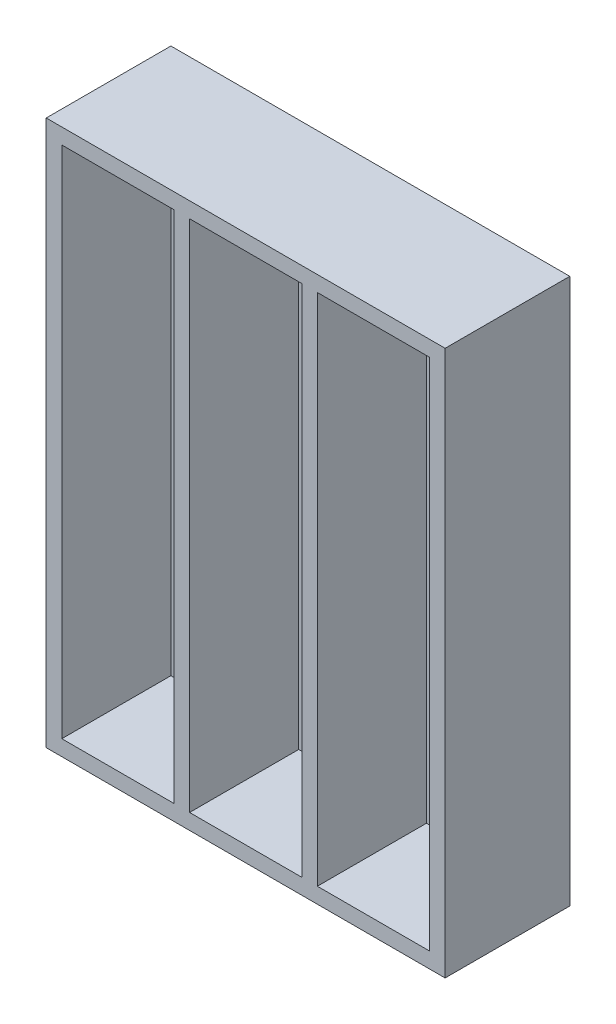
from build123d import *

# Parameters (mm, degrees)
ESQUISSE1_W        = 256
ESQUISSE1_H        = 350
BOSS_EXTRU_1_DEPTH = 10
ESQUISSE2_W        = 256
ESQUISSE2_H        = 350
ESQUISSE2_W_2      = 236
ESQUISSE2_H_2      = 330
BOSS_EXTRU_2_DEPTH = 70
ESQUISSE3_W        = 10
ESQUISSE3_H        = 330
BOSS_EXTRU_3_DEPTH = 70


with BuildPart() as part:
    # Esquisse1 → Boss.-Extru.1 (new body)
    with BuildSketch(Plane.XY):
        with Locations((128, 175)):
            Rectangle(ESQUISSE1_W, ESQUISSE1_H)
    extrude(amount=BOSS_EXTRU_1_DEPTH)

    # Esquisse2 → Boss.-Extru.2 (add)
    with BuildSketch(Plane.XY.offset(10)):
        with Locations((128, 175)):
            Rectangle(ESQUISSE2_W, ESQUISSE2_H)
        with Locations((128, 175)):
            Rectangle(ESQUISSE2_W_2, ESQUISSE2_H_2, mode=Mode.SUBTRACT)
    extrude(amount=BOSS_EXTRU_2_DEPTH)

    # Esquisse3 → Boss.-Extru.3 (add)
    with BuildSketch(Plane.XY.offset(10)):
        with Locations((87, 175)):
            Rectangle(ESQUISSE3_W, ESQUISSE3_H)
        with Locations((169, 175)):
            Rectangle(ESQUISSE3_W, ESQUISSE3_H)
    extrude(amount=BOSS_EXTRU_3_DEPTH)


solid = part.part
